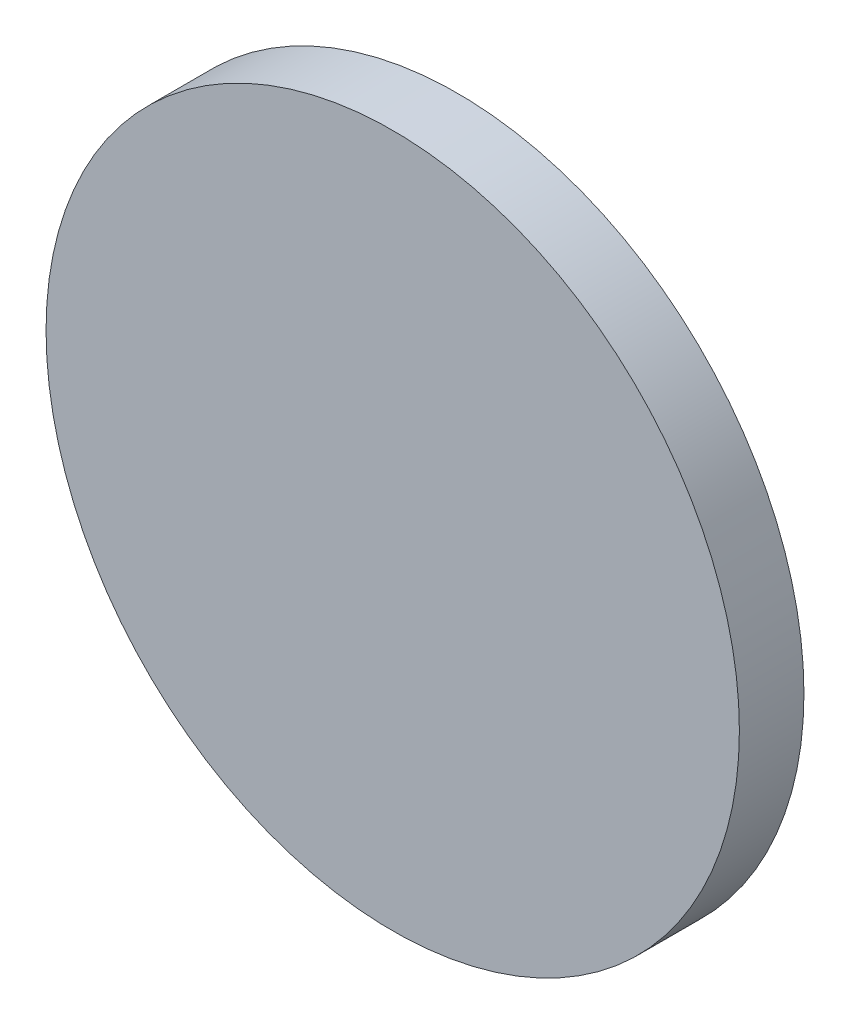
from build123d import *

# Parameters (mm, degrees)
SKETCH1_R           = 53.698142505
BOSS_EXTRUDE1_DEPTH = 10


with BuildPart() as part:
    # Sketch1 → Boss-Extrude1 (new body)
    with BuildSketch(Plane.XY):
        Circle(SKETCH1_R)
    extrude(amount=BOSS_EXTRUDE1_DEPTH)


solid = part.part
